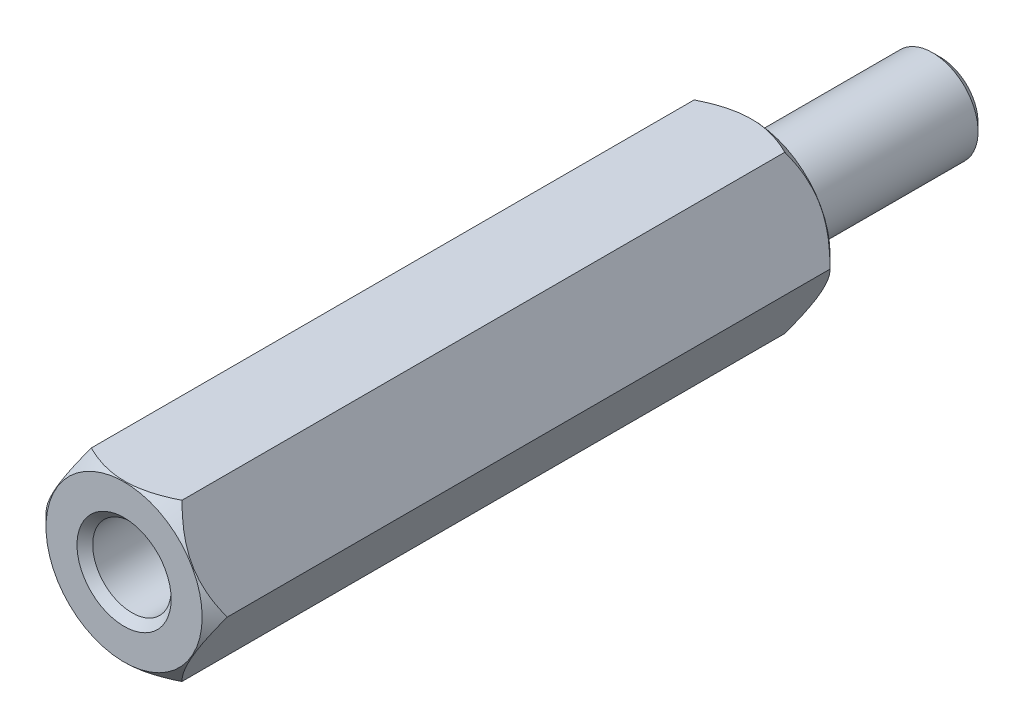
from build123d import *

# Parameters (mm, degrees)
HEX_2_DEPTH                 = 10
TAP_DRILL_FOR_M3X0_5_TAP1_D = 2.5
THREAD_DEPTH                = 6
THREAD_DEPTH_BACK           = 2
SKETCH8_R                   = 1.45
INNERCHAMFER_SIZE           = 0.25


with BuildPart() as part:
    # Sketch1 → HEX 2 (new, symmetric)
    with BuildSketch(Plane.XY):
        Polygon((2.886751346, 0), (1.443375673, 2.5), (-1.443375673, 2.5), (-2.886751346, 0), (-1.443375673, -2.5), (1.443375673, -2.5), align=None)
    extrude(amount=HEX_2_DEPTH, both=True)

    # Tap Drill for M3x0.5 Tap1 (through all)
    with Locations(Plane.XY.offset(10)):
        with Locations((0, 0)):
            Hole(TAP_DRILL_FOR_M3X0_5_TAP1_D / 2)

    # Sketch7 → HexChamfer (revolve, cut)
    with BuildSketch(Plane(origin=(0, 0, 0), x_dir=(1, 0, 0), z_dir=(0, 1, 0)), mode=Mode.PRIVATE) as hexchamfer_sk:
        Polygon((-2.886751346, 10), (-2.886751346, 9.6), (-2.486751346, 10), align=None)
    hexchamfer = revolve(hexchamfer_sk.sketch.rotate(Axis((0, 0, 15.266742202), (0, 0, -1)), 180), axis=Axis((0, 0, 15.266742202), (0, 0, -1)), mode=Mode.SUBTRACT)

    # Mirror1: HexChamfer across plane
    add(hexchamfer.mirror(Plane.XY), mode=Mode.SUBTRACT)

    # Sketch8 → Thread (add, two sides: drawn at the far end of the back side and taken through both)
    with BuildSketch(Plane(origin=(0, 0, -10), x_dir=(-1, 0, 0), z_dir=(0, 0, -1)).offset(-THREAD_DEPTH_BACK)):
        Circle(SKETCH8_R)
    extrude(amount=THREAD_DEPTH + THREAD_DEPTH_BACK)

    # InnerChamfer
    innerchamfer_edges = [part.edges().sort_by_distance(p)[0] for p in [
        (1.25, 0, 10),
        (1.45, 0, -10),
        (1.45, 0, -16),
    ]]
    chamfer(innerchamfer_edges, length=INNERCHAMFER_SIZE)


solid = part.part
